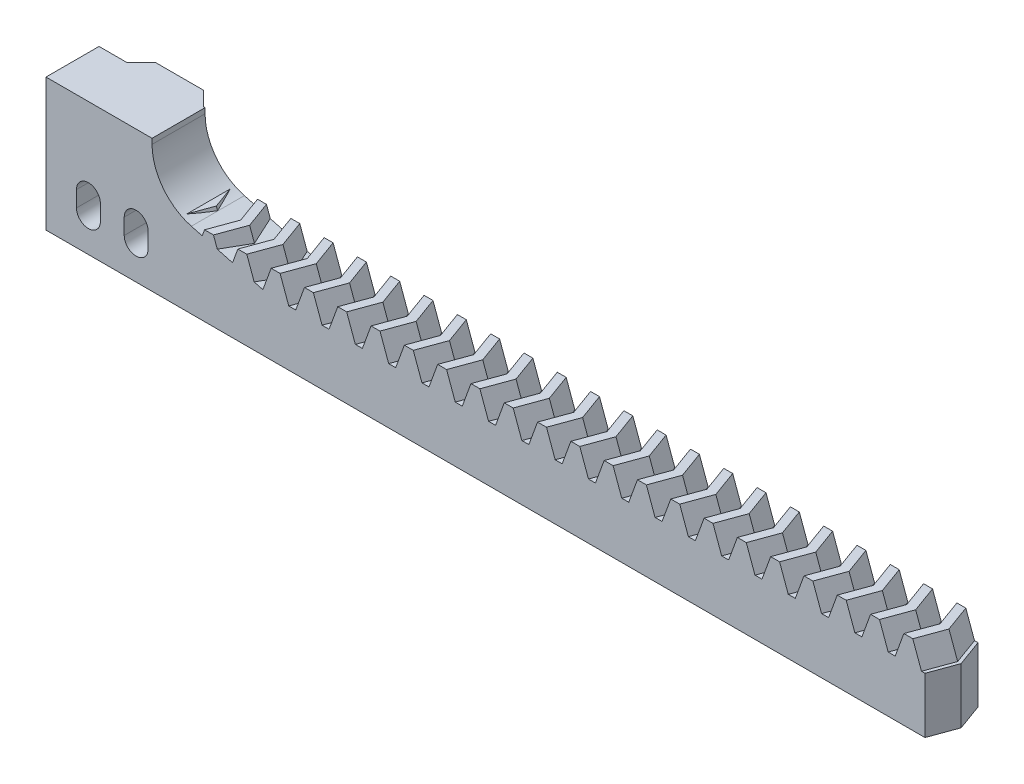
from build123d import *

# Parameters (mm, degrees)
LPATTERN2_COUNT     = 24
LPATTERN2_PITCH     = 6.28
BOSS_EXTRUDE1_DEPTH = 10
BOSS_EXTRUDE2_DEPTH = 25
CUT_EXTRUDE1_DEPTH  = 149.833451885


with BuildPart() as part:
    # Sweep1: sweep along a path in Sketch2
    with BuildLine(Plane(origin=(0, 0, 0), x_dir=(1, 0, 0), z_dir=(0, 1, 0))) as sweep1_path:
        Line((0, 0), (-1.819851171, 5))
    # Sketch1 → Sweep1 (sweep)
    with BuildSketch(Plane.XY):
        Polygon((-3.14, -10.5), (3.14, -10.5), (3.14, 0), (2.479925586, 0), (0.842059531, 4.5), (-0.842059531, 4.5), (-2.479925586, 0), (-3.14, 0), align=None)
    sweep1 = sweep(path=sweep1_path.line)

    # Mirror2: Sweep1 across plane
    add(sweep1.mirror(Plane.XY))

    # LPattern2: Sweep1 ×24
    with Locations(*[(i * LPATTERN2_PITCH, 0, 0) for i in range(1, LPATTERN2_COUNT)]):
        add(sweep1)

    # LPattern2 copy 1: sweep along a path in LPattern2 copy 1 path
    with BuildLine(Plane(origin=(6.28, 0, 0), x_dir=(1, 0, 0), z_dir=(0, 1, 0))) as lpattern2_copy_1_path:
        Line((0, 0), (-1.819851171, -5))
    # LPattern2 copy 1 sketch → LPattern2 copy 1 (sweep)
    with BuildSketch(Plane(origin=(6.28, 0, 0), x_dir=(1, 0, 0), z_dir=(0, 0, -1))):
        Polygon((-3.14, 10.5), (3.14, 10.5), (3.14, 0), (2.479925586, 0), (0.842059531, -4.5), (-0.842059531, -4.5), (-2.479925586, 0), (-3.14, 0), align=None)
    sweep(path=lpattern2_copy_1_path.line)

    # LPattern2 copy 2: sweep along a path in LPattern2 copy 2 path
    with BuildLine(Plane(origin=(12.56, 0, 0), x_dir=(1, 0, 0), z_dir=(0, 1, 0))) as lpattern2_copy_2_path:
        Line((0, 0), (-1.819851171, -5))
    # LPattern2 copy 2 sketch → LPattern2 copy 2 (sweep)
    with BuildSketch(Plane(origin=(12.56, 0, 0), x_dir=(1, 0, 0), z_dir=(0, 0, -1))):
        Polygon((-3.14, 10.5), (3.14, 10.5), (3.14, 0), (2.479925586, 0), (0.842059531, -4.5), (-0.842059531, -4.5), (-2.479925586, 0), (-3.14, 0), align=None)
    sweep(path=lpattern2_copy_2_path.line)

    # LPattern2 copy 3: sweep along a path in LPattern2 copy 3 path
    with BuildLine(Plane(origin=(18.84, 0, 0), x_dir=(1, 0, 0), z_dir=(0, 1, 0))) as lpattern2_copy_3_path:
        Line((0, 0), (-1.819851171, -5))
    # LPattern2 copy 3 sketch → LPattern2 copy 3 (sweep)
    with BuildSketch(Plane(origin=(18.84, 0, 0), x_dir=(1, 0, 0), z_dir=(0, 0, -1))):
        Polygon((-3.14, 10.5), (3.14, 10.5), (3.14, 0), (2.479925586, 0), (0.842059531, -4.5), (-0.842059531, -4.5), (-2.479925586, 0), (-3.14, 0), align=None)
    sweep(path=lpattern2_copy_3_path.line)

    # LPattern2 copy 4: sweep along a path in LPattern2 copy 4 path
    with BuildLine(Plane(origin=(25.12, 0, 0), x_dir=(1, 0, 0), z_dir=(0, 1, 0))) as lpattern2_copy_4_path:
        Line((0, 0), (-1.819851171, -5))
    # LPattern2 copy 4 sketch → LPattern2 copy 4 (sweep)
    with BuildSketch(Plane(origin=(25.12, 0, 0), x_dir=(1, 0, 0), z_dir=(0, 0, -1))):
        Polygon((-3.14, 10.5), (3.14, 10.5), (3.14, 0), (2.479925586, 0), (0.842059531, -4.5), (-0.842059531, -4.5), (-2.479925586, 0), (-3.14, 0), align=None)
    sweep(path=lpattern2_copy_4_path.line)

    # LPattern2 copy 5: sweep along a path in LPattern2 copy 5 path
    with BuildLine(Plane(origin=(31.4, 0, 0), x_dir=(1, 0, 0), z_dir=(0, 1, 0))) as lpattern2_copy_5_path:
        Line((0, 0), (-1.819851171, -5))
    # LPattern2 copy 5 sketch → LPattern2 copy 5 (sweep)
    with BuildSketch(Plane(origin=(31.4, 0, 0), x_dir=(1, 0, 0), z_dir=(0, 0, -1))):
        Polygon((-3.14, 10.5), (3.14, 10.5), (3.14, 0), (2.479925586, 0), (0.842059531, -4.5), (-0.842059531, -4.5), (-2.479925586, 0), (-3.14, 0), align=None)
    sweep(path=lpattern2_copy_5_path.line)

    # LPattern2 copy 6: sweep along a path in LPattern2 copy 6 path
    with BuildLine(Plane(origin=(37.68, 0, 0), x_dir=(1, 0, 0), z_dir=(0, 1, 0))) as lpattern2_copy_6_path:
        Line((0, 0), (-1.819851171, -5))
    # LPattern2 copy 6 sketch → LPattern2 copy 6 (sweep)
    with BuildSketch(Plane(origin=(37.68, 0, 0), x_dir=(1, 0, 0), z_dir=(0, 0, -1))):
        Polygon((-3.14, 10.5), (3.14, 10.5), (3.14, 0), (2.479925586, 0), (0.842059531, -4.5), (-0.842059531, -4.5), (-2.479925586, 0), (-3.14, 0), align=None)
    sweep(path=lpattern2_copy_6_path.line)

    # LPattern2 copy 7: sweep along a path in LPattern2 copy 7 path
    with BuildLine(Plane(origin=(43.96, 0, 0), x_dir=(1, 0, 0), z_dir=(0, 1, 0))) as lpattern2_copy_7_path:
        Line((0, 0), (-1.819851171, -5))
    # LPattern2 copy 7 sketch → LPattern2 copy 7 (sweep)
    with BuildSketch(Plane(origin=(43.96, 0, 0), x_dir=(1, 0, 0), z_dir=(0, 0, -1))):
        Polygon((-3.14, 10.5), (3.14, 10.5), (3.14, 0), (2.479925586, 0), (0.842059531, -4.5), (-0.842059531, -4.5), (-2.479925586, 0), (-3.14, 0), align=None)
    sweep(path=lpattern2_copy_7_path.line)

    # LPattern2 copy 8: sweep along a path in LPattern2 copy 8 path
    with BuildLine(Plane(origin=(50.24, 0, 0), x_dir=(1, 0, 0), z_dir=(0, 1, 0))) as lpattern2_copy_8_path:
        Line((0, 0), (-1.819851171, -5))
    # LPattern2 copy 8 sketch → LPattern2 copy 8 (sweep)
    with BuildSketch(Plane(origin=(50.24, 0, 0), x_dir=(1, 0, 0), z_dir=(0, 0, -1))):
        Polygon((-3.14, 10.5), (3.14, 10.5), (3.14, 0), (2.479925586, 0), (0.842059531, -4.5), (-0.842059531, -4.5), (-2.479925586, 0), (-3.14, 0), align=None)
    sweep(path=lpattern2_copy_8_path.line)

    # LPattern2 copy 9: sweep along a path in LPattern2 copy 9 path
    with BuildLine(Plane(origin=(56.52, 0, 0), x_dir=(1, 0, 0), z_dir=(0, 1, 0))) as lpattern2_copy_9_path:
        Line((0, 0), (-1.819851171, -5))
    # LPattern2 copy 9 sketch → LPattern2 copy 9 (sweep)
    with BuildSketch(Plane(origin=(56.52, 0, 0), x_dir=(1, 0, 0), z_dir=(0, 0, -1))):
        Polygon((-3.14, 10.5), (3.14, 10.5), (3.14, 0), (2.479925586, 0), (0.842059531, -4.5), (-0.842059531, -4.5), (-2.479925586, 0), (-3.14, 0), align=None)
    sweep(path=lpattern2_copy_9_path.line)

    # LPattern2 copy 10: sweep along a path in LPattern2 copy 10 path
    with BuildLine(Plane(origin=(62.8, 0, 0), x_dir=(1, 0, 0), z_dir=(0, 1, 0))) as lpattern2_copy_10_path:
        Line((0, 0), (-1.819851171, -5))
    # LPattern2 copy 10 sketch → LPattern2 copy 10 (sweep)
    with BuildSketch(Plane(origin=(62.8, 0, 0), x_dir=(1, 0, 0), z_dir=(0, 0, -1))):
        Polygon((-3.14, 10.5), (3.14, 10.5), (3.14, 0), (2.479925586, 0), (0.842059531, -4.5), (-0.842059531, -4.5), (-2.479925586, 0), (-3.14, 0), align=None)
    sweep(path=lpattern2_copy_10_path.line)

    # LPattern2 copy 11: sweep along a path in LPattern2 copy 11 path
    with BuildLine(Plane(origin=(69.08, 0, 0), x_dir=(1, 0, 0), z_dir=(0, 1, 0))) as lpattern2_copy_11_path:
        Line((0, 0), (-1.819851171, -5))
    # LPattern2 copy 11 sketch → LPattern2 copy 11 (sweep)
    with BuildSketch(Plane(origin=(69.08, 0, 0), x_dir=(1, 0, 0), z_dir=(0, 0, -1))):
        Polygon((-3.14, 10.5), (3.14, 10.5), (3.14, 0), (2.479925586, 0), (0.842059531, -4.5), (-0.842059531, -4.5), (-2.479925586, 0), (-3.14, 0), align=None)
    sweep(path=lpattern2_copy_11_path.line)

    # LPattern2 copy 12: sweep along a path in LPattern2 copy 12 path
    with BuildLine(Plane(origin=(75.36, 0, 0), x_dir=(1, 0, 0), z_dir=(0, 1, 0))) as lpattern2_copy_12_path:
        Line((0, 0), (-1.819851171, -5))
    # LPattern2 copy 12 sketch → LPattern2 copy 12 (sweep)
    with BuildSketch(Plane(origin=(75.36, 0, 0), x_dir=(1, 0, 0), z_dir=(0, 0, -1))):
        Polygon((-3.14, 10.5), (3.14, 10.5), (3.14, 0), (2.479925586, 0), (0.842059531, -4.5), (-0.842059531, -4.5), (-2.479925586, 0), (-3.14, 0), align=None)
    sweep(path=lpattern2_copy_12_path.line)

    # LPattern2 copy 13: sweep along a path in LPattern2 copy 13 path
    with BuildLine(Plane(origin=(81.64, 0, 0), x_dir=(1, 0, 0), z_dir=(0, 1, 0))) as lpattern2_copy_13_path:
        Line((0, 0), (-1.819851171, -5))
    # LPattern2 copy 13 sketch → LPattern2 copy 13 (sweep)
    with BuildSketch(Plane(origin=(81.64, 0, 0), x_dir=(1, 0, 0), z_dir=(0, 0, -1))):
        Polygon((-3.14, 10.5), (3.14, 10.5), (3.14, 0), (2.479925586, 0), (0.842059531, -4.5), (-0.842059531, -4.5), (-2.479925586, 0), (-3.14, 0), align=None)
    sweep(path=lpattern2_copy_13_path.line)

    # LPattern2 copy 14: sweep along a path in LPattern2 copy 14 path
    with BuildLine(Plane(origin=(87.92, 0, 0), x_dir=(1, 0, 0), z_dir=(0, 1, 0))) as lpattern2_copy_14_path:
        Line((0, 0), (-1.819851171, -5))
    # LPattern2 copy 14 sketch → LPattern2 copy 14 (sweep)
    with BuildSketch(Plane(origin=(87.92, 0, 0), x_dir=(1, 0, 0), z_dir=(0, 0, -1))):
        Polygon((-3.14, 10.5), (3.14, 10.5), (3.14, 0), (2.479925586, 0), (0.842059531, -4.5), (-0.842059531, -4.5), (-2.479925586, 0), (-3.14, 0), align=None)
    sweep(path=lpattern2_copy_14_path.line)

    # LPattern2 copy 15: sweep along a path in LPattern2 copy 15 path
    with BuildLine(Plane(origin=(94.2, 0, 0), x_dir=(1, 0, 0), z_dir=(0, 1, 0))) as lpattern2_copy_15_path:
        Line((0, 0), (-1.819851171, -5))
    # LPattern2 copy 15 sketch → LPattern2 copy 15 (sweep)
    with BuildSketch(Plane(origin=(94.2, 0, 0), x_dir=(1, 0, 0), z_dir=(0, 0, -1))):
        Polygon((-3.14, 10.5), (3.14, 10.5), (3.14, 0), (2.479925586, 0), (0.842059531, -4.5), (-0.842059531, -4.5), (-2.479925586, 0), (-3.14, 0), align=None)
    sweep(path=lpattern2_copy_15_path.line)

    # LPattern2 copy 16: sweep along a path in LPattern2 copy 16 path
    with BuildLine(Plane(origin=(100.48, 0, 0), x_dir=(1, 0, 0), z_dir=(0, 1, 0))) as lpattern2_copy_16_path:
        Line((0, 0), (-1.819851171, -5))
    # LPattern2 copy 16 sketch → LPattern2 copy 16 (sweep)
    with BuildSketch(Plane(origin=(100.48, 0, 0), x_dir=(1, 0, 0), z_dir=(0, 0, -1))):
        Polygon((-3.14, 10.5), (3.14, 10.5), (3.14, 0), (2.479925586, 0), (0.842059531, -4.5), (-0.842059531, -4.5), (-2.479925586, 0), (-3.14, 0), align=None)
    sweep(path=lpattern2_copy_16_path.line)

    # LPattern2 copy 17: sweep along a path in LPattern2 copy 17 path
    with BuildLine(Plane(origin=(106.76, 0, 0), x_dir=(1, 0, 0), z_dir=(0, 1, 0))) as lpattern2_copy_17_path:
        Line((0, 0), (-1.819851171, -5))
    # LPattern2 copy 17 sketch → LPattern2 copy 17 (sweep)
    with BuildSketch(Plane(origin=(106.76, 0, 0), x_dir=(1, 0, 0), z_dir=(0, 0, -1))):
        Polygon((-3.14, 10.5), (3.14, 10.5), (3.14, 0), (2.479925586, 0), (0.842059531, -4.5), (-0.842059531, -4.5), (-2.479925586, 0), (-3.14, 0), align=None)
    sweep(path=lpattern2_copy_17_path.line)

    # LPattern2 copy 18: sweep along a path in LPattern2 copy 18 path
    with BuildLine(Plane(origin=(113.04, 0, 0), x_dir=(1, 0, 0), z_dir=(0, 1, 0))) as lpattern2_copy_18_path:
        Line((0, 0), (-1.819851171, -5))
    # LPattern2 copy 18 sketch → LPattern2 copy 18 (sweep)
    with BuildSketch(Plane(origin=(113.04, 0, 0), x_dir=(1, 0, 0), z_dir=(0, 0, -1))):
        Polygon((-3.14, 10.5), (3.14, 10.5), (3.14, 0), (2.479925586, 0), (0.842059531, -4.5), (-0.842059531, -4.5), (-2.479925586, 0), (-3.14, 0), align=None)
    sweep(path=lpattern2_copy_18_path.line)

    # LPattern2 copy 19: sweep along a path in LPattern2 copy 19 path
    with BuildLine(Plane(origin=(119.32, 0, 0), x_dir=(1, 0, 0), z_dir=(0, 1, 0))) as lpattern2_copy_19_path:
        Line((0, 0), (-1.819851171, -5))
    # LPattern2 copy 19 sketch → LPattern2 copy 19 (sweep)
    with BuildSketch(Plane(origin=(119.32, 0, 0), x_dir=(1, 0, 0), z_dir=(0, 0, -1))):
        Polygon((-3.14, 10.5), (3.14, 10.5), (3.14, 0), (2.479925586, 0), (0.842059531, -4.5), (-0.842059531, -4.5), (-2.479925586, 0), (-3.14, 0), align=None)
    sweep(path=lpattern2_copy_19_path.line)

    # LPattern2 copy 20: sweep along a path in LPattern2 copy 20 path
    with BuildLine(Plane(origin=(125.6, 0, 0), x_dir=(1, 0, 0), z_dir=(0, 1, 0))) as lpattern2_copy_20_path:
        Line((0, 0), (-1.819851171, -5))
    # LPattern2 copy 20 sketch → LPattern2 copy 20 (sweep)
    with BuildSketch(Plane(origin=(125.6, 0, 0), x_dir=(1, 0, 0), z_dir=(0, 0, -1))):
        Polygon((-3.14, 10.5), (3.14, 10.5), (3.14, 0), (2.479925586, 0), (0.842059531, -4.5), (-0.842059531, -4.5), (-2.479925586, 0), (-3.14, 0), align=None)
    sweep(path=lpattern2_copy_20_path.line)

    # LPattern2 copy 21: sweep along a path in LPattern2 copy 21 path
    with BuildLine(Plane(origin=(131.88, 0, 0), x_dir=(1, 0, 0), z_dir=(0, 1, 0))) as lpattern2_copy_21_path:
        Line((0, 0), (-1.819851171, -5))
    # LPattern2 copy 21 sketch → LPattern2 copy 21 (sweep)
    with BuildSketch(Plane(origin=(131.88, 0, 0), x_dir=(1, 0, 0), z_dir=(0, 0, -1))):
        Polygon((-3.14, 10.5), (3.14, 10.5), (3.14, 0), (2.479925586, 0), (0.842059531, -4.5), (-0.842059531, -4.5), (-2.479925586, 0), (-3.14, 0), align=None)
    sweep(path=lpattern2_copy_21_path.line)

    # LPattern2 copy 22: sweep along a path in LPattern2 copy 22 path
    with BuildLine(Plane(origin=(138.16, 0, 0), x_dir=(1, 0, 0), z_dir=(0, 1, 0))) as lpattern2_copy_22_path:
        Line((0, 0), (-1.819851171, -5))
    # LPattern2 copy 22 sketch → LPattern2 copy 22 (sweep)
    with BuildSketch(Plane(origin=(138.16, 0, 0), x_dir=(1, 0, 0), z_dir=(0, 0, -1))):
        Polygon((-3.14, 10.5), (3.14, 10.5), (3.14, 0), (2.479925586, 0), (0.842059531, -4.5), (-0.842059531, -4.5), (-2.479925586, 0), (-3.14, 0), align=None)
    sweep(path=lpattern2_copy_22_path.line)

    # LPattern2 copy 23: sweep along a path in LPattern2 copy 23 path
    with BuildLine(Plane(origin=(144.44, 0, 0), x_dir=(1, 0, 0), z_dir=(0, 1, 0))) as lpattern2_copy_23_path:
        Line((0, 0), (-1.819851171, -5))
    # LPattern2 copy 23 sketch → LPattern2 copy 23 (sweep)
    with BuildSketch(Plane(origin=(144.44, 0, 0), x_dir=(1, 0, 0), z_dir=(0, 0, -1))):
        Polygon((-3.14, 10.5), (3.14, 10.5), (3.14, 0), (2.479925586, 0), (0.842059531, -4.5), (-0.842059531, -4.5), (-2.479925586, 0), (-3.14, 0), align=None)
    sweep(path=lpattern2_copy_23_path.line)

    # Sketch3 → Boss-Extrude1 (add)
    with BuildSketch(Plane.XY.offset(5)):
        with BuildLine():
            ThreePointArc((7.411809549, 3.840741737), (2.066466597, 7.41238571), (0, 13.5))
            Line((0, 13.5), (0, 14.5))
            Line((0, 14.5), (-20, 14.5))
            Line((-20, 14.5), (-20, -10.5))
            Line((-20, -10.5), (0, -10.5))
            Line((0, -10.5), (21.745652851, -10.5))
            Line((21.745652851, -10.5), (21.745652851, 0))
            Line((21.745652851, 0), (7.411809549, 3.840741737))
        make_face()
    extrude(amount=-BOSS_EXTRUDE1_DEPTH)

    # Sketch4 → Boss-Extrude2 (add)
    with BuildSketch(Plane(origin=(0, 14.5, 0), x_dir=(1, 0, 0), z_dir=(0, 1, 0))):
        Polygon((-14.7, 5), (-12, 7.7), (-3, 7.7), (-0.3, 5), align=None)
    extrude(amount=-BOSS_EXTRUDE2_DEPTH)

    # Sketch5 → Cut-Extrude1 (cut, through all)
    with BuildSketch(Plane.XY.offset(5)):
        with BuildLine():
            Line((-14.25, -4), (-14.25, -1))
            ThreePointArc((-14.25, -1), (-12, 1.25), (-9.75, -1))
            Line((-9.75, -1), (-9.75, -4))
            ThreePointArc((-9.75, -4), (-12, -6.25), (-14.25, -4))
        make_face()
        with BuildLine():
            Line((-5.25, -4), (-5.25, -1))
            ThreePointArc((-5.25, -1), (-3, 1.25), (-0.75, -1))
            Line((-0.75, -1), (-0.75, -4))
            ThreePointArc((-0.75, -4), (-3, -6.25), (-5.25, -4))
        make_face()
    extrude(amount=-CUT_EXTRUDE1_DEPTH, mode=Mode.SUBTRACT)


solid = part.part
